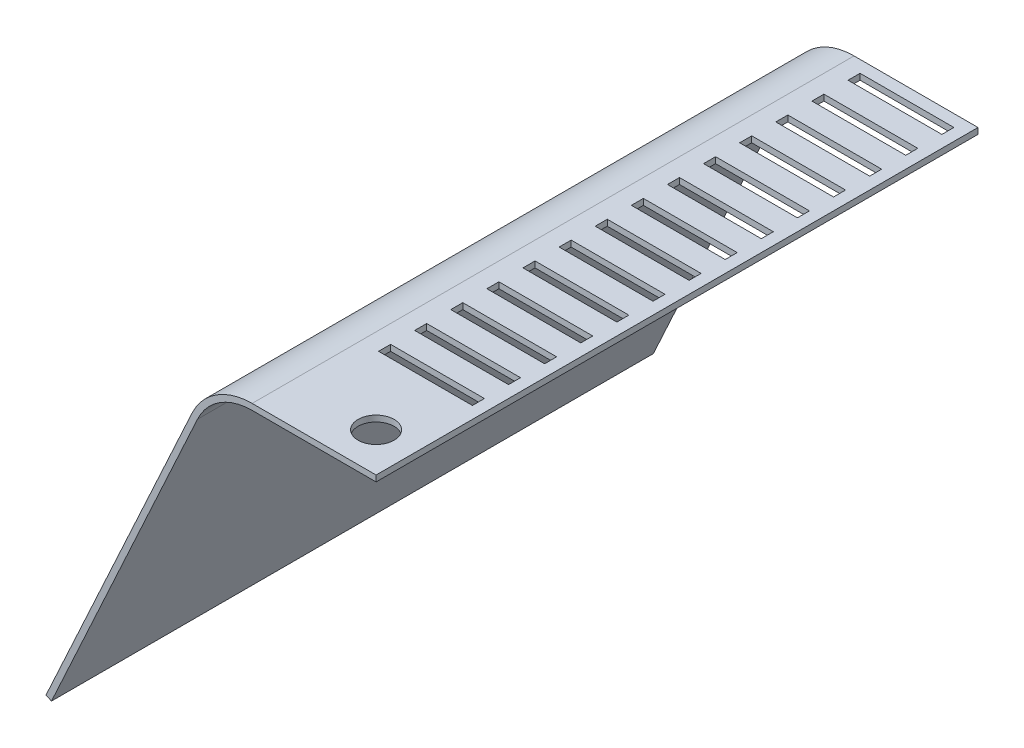
from build123d import *

# Parameters (mm, degrees)
EXTRUDE_THIN1_DEPTH = 500
SKETCH2_W           = 155.95
SKETCH2_H           = 20
CUT_EXTRUDE1_DEPTH  = 952.222140517
LPATTERN1_COUNT     = 14
LPATTERN1_PITCH     = 60
SKETCH3_R           = 30
CUT_EXTRUDE2_DEPTH  = 952.222140517


with BuildPart() as part:
    # Sketch1 → Extrude-Thin1 (new, symmetric)
    with BuildSketch(Plane.XY):
        with BuildLine():
            Line((0, 0), (-205.95, 0))
            ThreePointArc((-205.95, 0), (-259.885879639, -15.792394123), (-296.786225905, -58.181582248))
            Line((-296.786225905, -58.181582248), (-539.333048865, -585.0316925))
            Line((-539.333048865, -585.0316925), (-548.416671455, -580.849850725))
            Line((-548.416671455, -580.849850725), (-305.869848496, -53.999740473))
            ThreePointArc((-305.869848496, -53.999740473), (-265.279467603, -7.371633535), (-205.95, 10))
            Line((-205.95, 10), (0, 10))
            Line((0, 10), (0, 0))
        make_face()
    extrude(amount=EXTRUDE_THIN1_DEPTH, both=True)

    # Sketch2 → Cut-Extrude1 (cut, through all)
    with BuildSketch(Plane(origin=(0, 10, 0), x_dir=(1, 0, 0), z_dir=(0, 1, 0))):
        with Locations((-97.975, 470)):
            Rectangle(SKETCH2_W, SKETCH2_H)
    cut_extrude1 = extrude(amount=-CUT_EXTRUDE1_DEPTH, mode=Mode.SUBTRACT)

    # LPattern1: Cut-Extrude1 ×14
    with Locations(*[(0, 0, i * LPATTERN1_PITCH) for i in range(1, LPATTERN1_COUNT)]):
        add(cut_extrude1, mode=Mode.SUBTRACT)

    # Sketch3 → Cut-Extrude2 (cut, through all)
    with BuildSketch(Plane(origin=(0, 10, 0), x_dir=(1, 0, 0), z_dir=(0, 1, 0))):
        with Locations(Location((-65, -435, 0), (0, 0, 180))):
            Circle(SKETCH3_R)
    extrude(amount=-CUT_EXTRUDE2_DEPTH, mode=Mode.SUBTRACT)


solid = part.part
